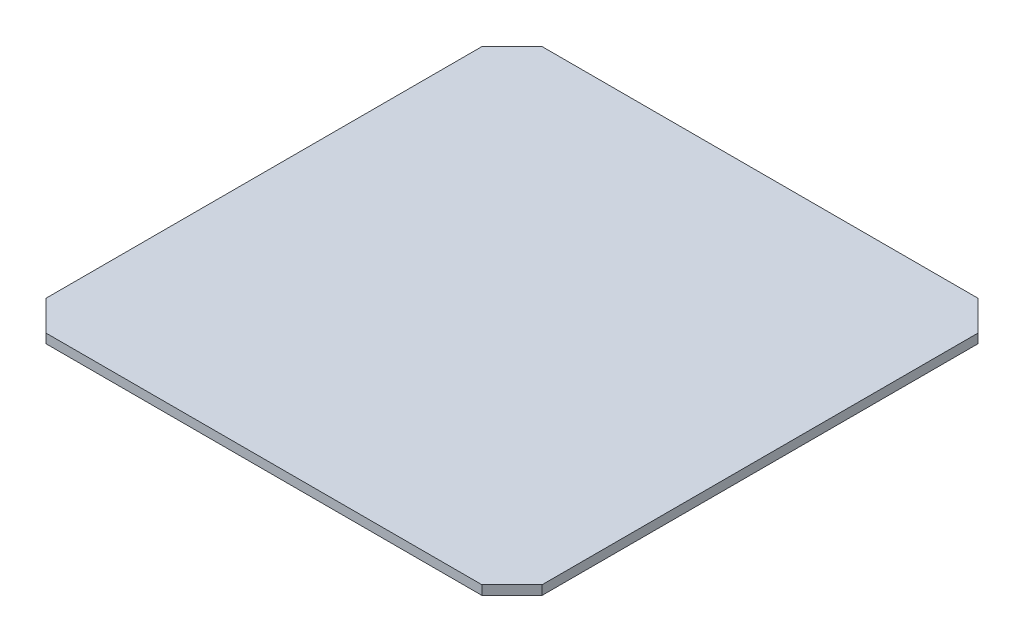
from build123d import *

# Parameters (mm, degrees)
SKETCH1_W           = 214
SKETCH1_H           = 214
BOSS_EXTRUDE1_DEPTH = 4
CHAMFER1_SIZE       = 13


with BuildPart() as part:
    # Sketch1 → Boss-Extrude1 (new body)
    with BuildSketch(Plane(origin=(0, 0, 0), x_dir=(1, 0, 0), z_dir=(0, 1, 0))):
        Rectangle(SKETCH1_W, SKETCH1_H)
    extrude(amount=BOSS_EXTRUDE1_DEPTH)

    # Chamfer1
    chamfer1_edges = [part.edges().sort_by_distance(p)[0] for p in [
        (107, 2, 107),
        (-107, 2, 107),
        (-107, 2, -107),
        (107, 2, -107),
    ]]
    chamfer(chamfer1_edges, length=CHAMFER1_SIZE)


solid = part.part
